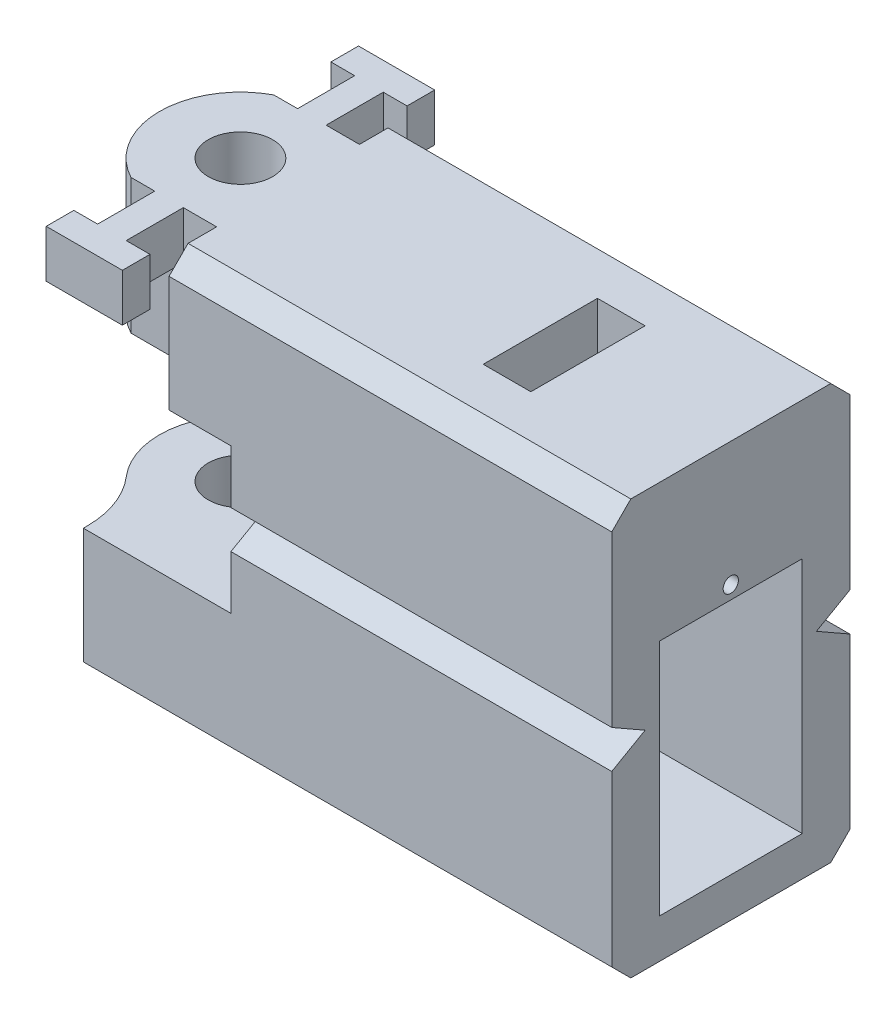
from build123d import *

# Parameters (mm, degrees)
BOSS_EXTRUDE1_DEPTH = 55.5
CHAMFER1_SIZE       = 2
SKETCH4_W           = 8
SKETCH4_H           = 32.8
BOSS_EXTRUDE2_DEPTH = 5
SKETCH7_W           = 3.5
SKETCH7_H           = 6
CUT_EXTRUDE5_DEPTH  = 10
SKETCH5_R           = 3.375
CUT_EXTRUDE3_DEPTH  = 77.250596562
SKETCH6_R           = 3.375
CUT_EXTRUDE4_DEPTH  = 7.62
SKETCH8_W           = 9
SKETCH8_H           = 5
CUT_EXTRUDE6_DEPTH  = 9.167
BOSS_EXTRUDE3_DEPTH = 14.167
BOSS_EXTRUDE4_START = -29.407
BOSS_EXTRUDE4_DEPTH = 14.167
FILLET1_R           = 10
SKETCH10_W          = 15
SKETCH10_H          = 25
CUT_EXTRUDE7_DEPTH  = 20
SKETCH11_R          = 0.8
CUT_EXTRUDE8_DEPTH  = 8
SKETCH12_W          = 5
SKETCH12_H          = 12
CUT_EXTRUDE9_DEPTH  = 14.437


with BuildPart() as part:
    # Sketch1 → Boss-Extrude1 (new body)
    with BuildSketch(Plane(origin=(0, 0, 0), x_dir=(0, 0, -1), z_dir=(1, 0, 0))):
        Polygon((0, 0), (25, 0), (25, 19.787), (21.5, 21.787), (25, 23.787), (25, 43.574), (0, 43.574), (0, 23.787), (3.5, 21.787), (0, 19.787), align=None)
    extrude(amount=BOSS_EXTRUDE1_DEPTH)

    # Chamfer1
    chamfer1_edges = [part.edges().sort_by_distance(p)[0] for p in [
        (27.75, 43.574, 0),
        (27.75, 43.574, -25),
        (27.75, 0, -25),
        (27.75, 0, 0),
    ]]
    chamfer(chamfer1_edges, length=CHAMFER1_SIZE)

    # Sketch4 → Boss-Extrude2 (add)
    with BuildSketch(Plane(origin=(0, 43.574, 0), x_dir=(1, 0, 0), z_dir=(0, 1, 0))):
        with Locations((4, 12.5)):
            Rectangle(SKETCH4_W, SKETCH4_H)
    extrude(amount=-BOSS_EXTRUDE2_DEPTH)

    # Sketch7 → Cut-Extrude5 (cut)
    with BuildSketch(Plane(origin=(0, 43.574, 0), x_dir=(1, 0, 0), z_dir=(0, 1, 0))):
        with Locations((7.25, 2)):
            Rectangle(SKETCH7_W, SKETCH7_H)
        with Locations((7.25, 23)):
            Rectangle(SKETCH7_W, SKETCH7_H)
        with Locations((0.75, 2)):
            Rectangle(SKETCH7_W, SKETCH7_H)
        with Locations((0.75, 23)):
            Rectangle(SKETCH7_W, SKETCH7_H)
    extrude(amount=-CUT_EXTRUDE5_DEPTH, mode=Mode.SUBTRACT)

    # Sketch5 → Cut-Extrude3 (cut, through all)
    with BuildSketch(Plane(origin=(0, 43.574, 0), x_dir=(1, 0, 0), z_dir=(0, 1, 0))):
        with Locations(Location((4, 12.5, 0), (0, 0, 270))):
            Circle(SKETCH5_R)
    extrude(amount=-CUT_EXTRUDE3_DEPTH, mode=Mode.SUBTRACT)

    # Sketch6 → Cut-Extrude4 (cut, symmetric)
    with BuildSketch(Plane(origin=(0, 21.787, 0), x_dir=(-1, 0, 0), z_dir=(0, -1, 0))):
        Polygon((-4, 30), (4.5, 30), (4.5, -5), (-4, -5), (-15.5, -5), (-15.5, 30), align=None)
        with Locations(Location((-4, 12.5, 0), (0, 0, 270))):
            Circle(SKETCH6_R, mode=Mode.SUBTRACT)
    extrude(amount=CUT_EXTRUDE4_DEPTH, both=True, mode=Mode.SUBTRACT)

    # Sketch8 → Cut-Extrude6 (cut)
    with BuildSketch(Plane.XZ.offset(-29.407)):
        with Locations((4.5, -22.5)):
            Rectangle(SKETCH8_W, SKETCH8_H)
        with Locations((4.5, -2.5)):
            Rectangle(SKETCH8_W, SKETCH8_H)
    extrude(amount=-CUT_EXTRUDE6_DEPTH, mode=Mode.SUBTRACT)

    # Sketch9 → Boss-Extrude3 (add)
    with BuildSketch(Plane(origin=(0, 43.574, 0), x_dir=(1, 0, 0), z_dir=(0, 1, 0))):
        with BuildLine():
            Line((0, 20), (0, 5))
            ThreePointArc((0, 5), (-4.5, 12.5), (0, 20))
        make_face()
    extrude(amount=-BOSS_EXTRUDE3_DEPTH)

    # Sketch9<2> → Boss-Extrude4 (add)
    with BuildSketch(Plane(origin=(0, 43.574, 0), x_dir=(1, 0, 0), z_dir=(0, 1, 0)).offset(BOSS_EXTRUDE4_START)):
        with BuildLine():
            Line((0, 20), (0, 5))
            ThreePointArc((0, 5), (-4.5, 12.5), (0, 20))
        make_face()
    extrude(amount=-BOSS_EXTRUDE4_DEPTH)

    # Fillet1
    fillet1_edges = [part.edges().sort_by_distance(p)[0] for p in [
        (0, 7.0835, -20),
        (0, 7.0835, -5),
    ]]
    fillet(fillet1_edges, radius=FILLET1_R)

    # Sketch10 → Cut-Extrude7 (cut)
    with BuildSketch(Plane(origin=(55.5, 0, 0), x_dir=(0, 0, -1), z_dir=(1, 0, 0))):
        with Locations((12.5, 16.637)):
            Rectangle(SKETCH10_W, SKETCH10_H)
    extrude(amount=-CUT_EXTRUDE7_DEPTH, mode=Mode.SUBTRACT)

    # Sketch11 → Cut-Extrude8 (cut)
    with BuildSketch(Plane(origin=(55.5, 0, 0), x_dir=(0, 0, -1), z_dir=(1, 0, 0))):
        with Locations((12.5, 30.537)):
            Circle(SKETCH11_R)
    extrude(amount=-CUT_EXTRUDE8_DEPTH, mode=Mode.SUBTRACT)

    # Sketch12 → Cut-Extrude9 (cut)
    with BuildSketch(Plane(origin=(0, 43.574, 0), x_dir=(1, 0, 0), z_dir=(0, 1, 0))):
        with Locations((38, 12.5)):
            Rectangle(SKETCH12_W, SKETCH12_H)
    extrude(amount=-CUT_EXTRUDE9_DEPTH, mode=Mode.SUBTRACT)


solid = part.part
